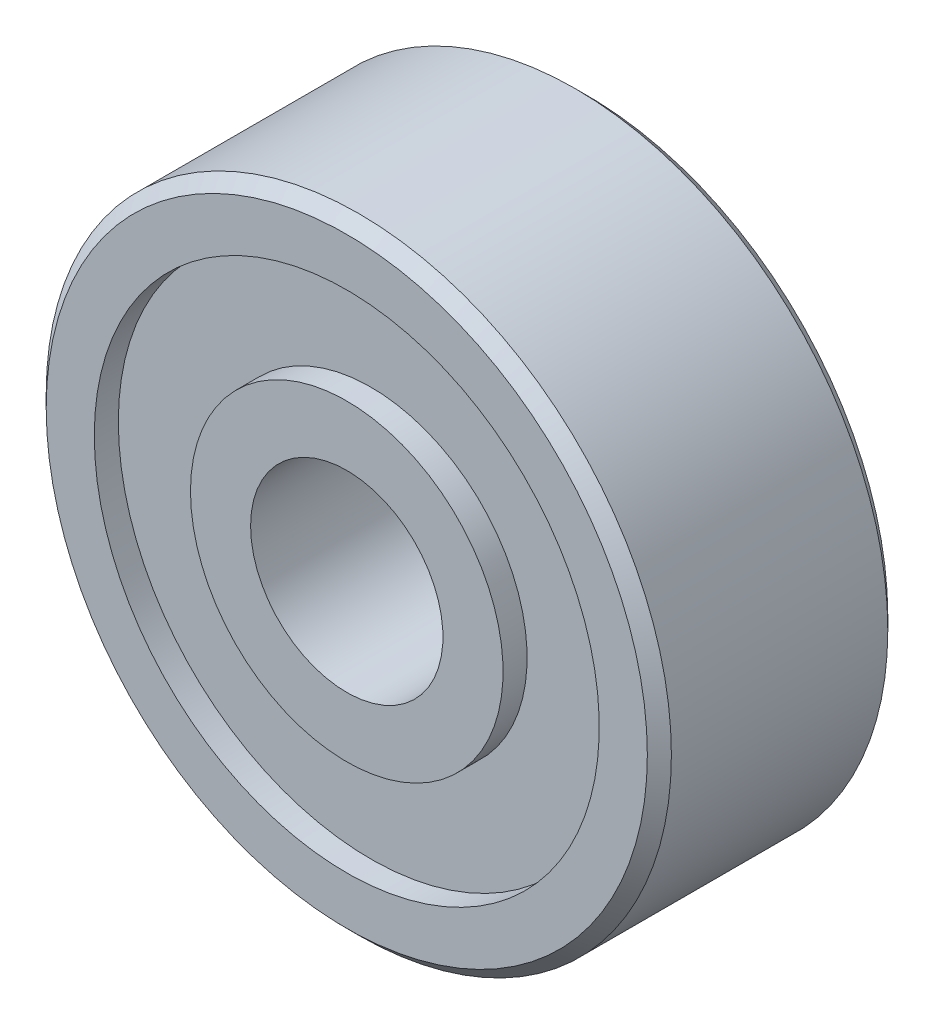
from build123d import *


with BuildPart() as part:
    # Sketch1 → Revolve1 (revolve)
    with BuildSketch(Plane.XZ, mode=Mode.PRIVATE) as revolve1_sk:
        Polygon((6.5, 2.25), (6.25, 2.5), (5.25, 2.5), (5.25, 2), (3.25, 2), (3.25, 2.5), (2, 2.5), (2, -2.5), (3.25, -2.5), (3.25, -2), (5.25, -2), (5.25, -2.5), (6.25, -2.5), (6.5, -2.25), align=None)
    revolve(revolve1_sk.sketch.rotate(Axis((0, 0, 2.5), (0, 0, -1)), 180), axis=Axis((0, 0, 2.5), (0, 0, -1)))


solid = part.part
